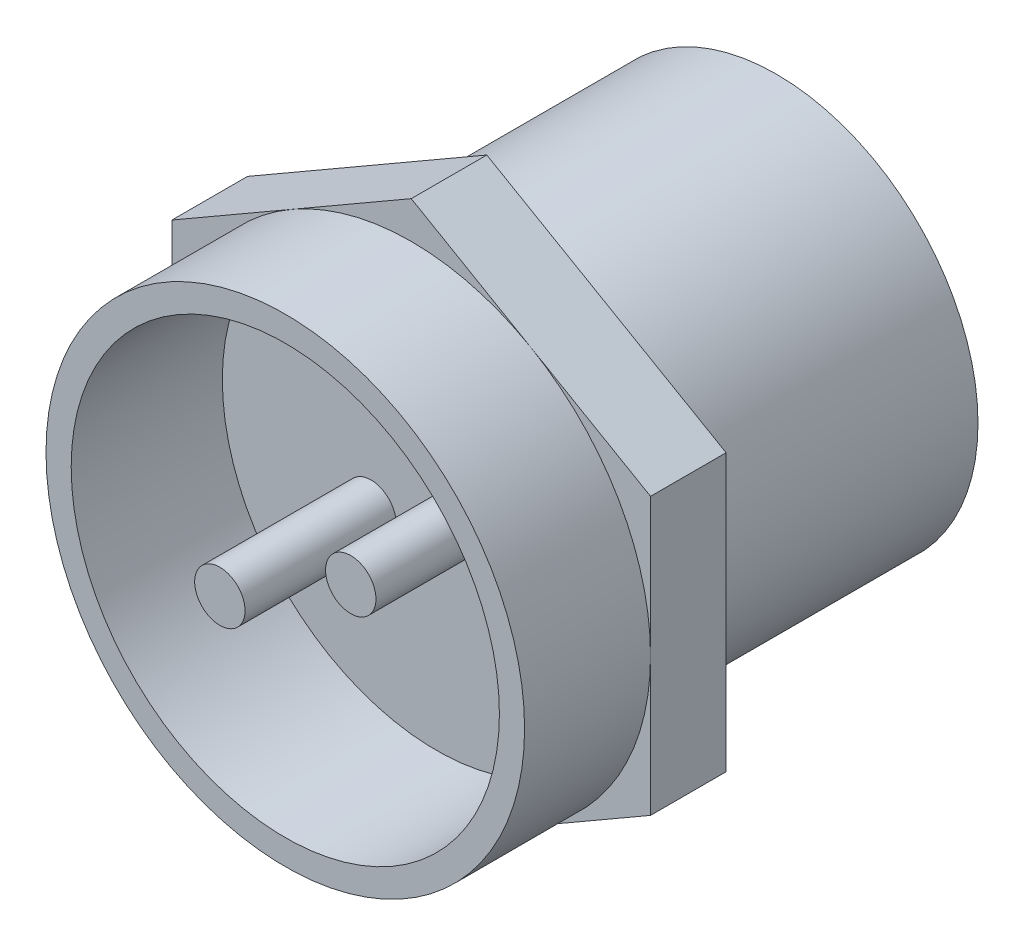
from build123d import *

# Parameters (mm, degrees)
SKETCH_1_R          = 9.5
EXTRUDE_1_DEPTH     = 5
SKETCH_2_R          = 8
EXTRUDE_2_DEPTH     = 11.5
EXTRUDE_3_DEPTH     = 3
SKETCH_4_R          = 9.5
EXTRUDE_4_DEPTH     = 3
SKETCH_5_R          = 8.5
SKETCH_5_R_2        = 1
CUT_EXTRUDE_2_DEPTH = 6


with BuildPart() as part:
    # 草图1 → 凸台-拉伸1 (new body)
    with BuildSketch(Plane.XY):
        Circle(SKETCH_1_R)
    extrude(amount=EXTRUDE_1_DEPTH)

    # 草图2 → 凸台-拉伸2 (add)
    with BuildSketch(Plane(origin=(0, 0, 0), x_dir=(-1, 0, 0), z_dir=(0, 0, -1))):
        with Locations(Location((0, 0, 0), (0, 0, 180))):
            Circle(SKETCH_2_R)
    extrude(amount=EXTRUDE_2_DEPTH)

    # 草图3 → 凸台-拉伸3 (add)
    with BuildSketch(Plane(origin=(0, 0, 0), x_dir=(-1, 0, 0), z_dir=(0, 0, -1))):
        Polygon((0, 10.969655115), (-9.5, 5.484827557), (-9.5, -5.484827557), (0, -10.969655115), (9.5, -5.484827557), (9.5, 5.484827557), align=None)
    extrude(amount=-EXTRUDE_3_DEPTH)

    # 草图4 → 凸台-拉伸4 (add)
    with BuildSketch(Plane.XY.offset(5)):
        Circle(SKETCH_4_R)
    extrude(amount=EXTRUDE_4_DEPTH)

    # 草图5 → 切除-拉伸2 (cut)
    with BuildSketch(Plane.XY.offset(8)):
        Circle(SKETCH_5_R)
        with Locations((2.598076211, 1.5)):
            Circle(SKETCH_5_R_2, mode=Mode.SUBTRACT)
        with Locations((-2.598076211, -1.5)):
            Circle(SKETCH_5_R_2, mode=Mode.SUBTRACT)
    extrude(amount=-CUT_EXTRUDE_2_DEPTH, mode=Mode.SUBTRACT)


solid = part.part
